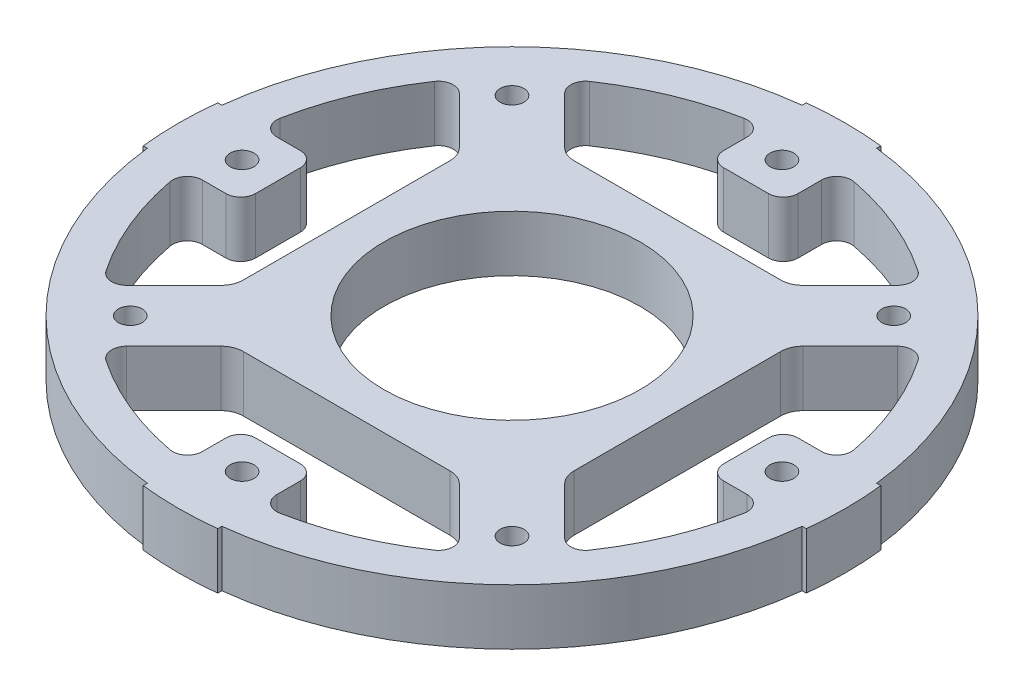
from build123d import *

# Parameters (mm, degrees)
SKETCH1_R           = 1.6
BOSS_EXTRUDE1_DEPTH = 7.5
SKETCH2_R           = 17.2
BOSS_EXTRUDE2_DEPTH = 7.5


with BuildPart() as part:
    # Sketch1 → Boss-Extrude1 (new body)
    with BuildSketch(Plane(origin=(0, 0, 0), x_dir=(1, 0, 0), z_dir=(0, 1, 0))):
        with BuildLine():
            Line((-5, 43.966606646), (-5, 44.520107817))
            ThreePointArc((-5, 44.520107817), (0, 44.8), (5, 44.520107817))
            Line((5, 44.520107817), (5, 43.966606646))
            ThreePointArc((5, 43.966606646), (31.289475068, 31.289475068), (43.966606646, 5))
            Line((43.966606646, 5), (44.520107817, 5))
            ThreePointArc((44.520107817, 5), (44.8, 0), (44.520107817, -5))
            Line((44.520107817, -5), (43.966606646, -5))
            ThreePointArc((43.966606646, -5), (31.289475068, -31.289475068), (5, -43.966606646))
            Line((5, -43.966606646), (5, -44.520107817))
            ThreePointArc((5, -44.520107817), (0, -44.8), (-5, -44.520107817))
            Line((-5, -44.520107817), (-5, -43.966606646))
            ThreePointArc((-5, -43.966606646), (-31.289475068, -31.289475068), (-43.966606646, -5))
            Line((-43.966606646, -5), (-44.520107817, -5))
            ThreePointArc((-44.520107817, -5), (-44.8, 0), (-44.520107817, 5))
            Line((-44.520107817, 5), (-43.966606646, 5))
            ThreePointArc((-43.966606646, 5), (-31.289475068, 31.289475068), (-5, 43.966606646))
        make_face()
        with Locations(Location((36.25, 0, 0), (0, 0, 270))):
            Circle(SKETCH1_R, mode=Mode.SUBTRACT)
        with Locations(Location((25.632620818, -25.632620818, 0), (0, 0, 270))):
            Circle(SKETCH1_R, mode=Mode.SUBTRACT)
        with Locations(Location((0, -36.25, 0), (0, 0, 270))):
            Circle(SKETCH1_R, mode=Mode.SUBTRACT)
        with Locations(Location((-25.632620818, -25.632620818, 0), (0, 0, 270))):
            Circle(SKETCH1_R, mode=Mode.SUBTRACT)
        with Locations(Location((-36.25, 0, 0), (0, 0, 270))):
            Circle(SKETCH1_R, mode=Mode.SUBTRACT)
        with Locations(Location((-25.632620818, 25.632620818, 0), (0, 0, 270))):
            Circle(SKETCH1_R, mode=Mode.SUBTRACT)
        with Locations(Location((0, 36.25, 0), (0, 0, 270))):
            Circle(SKETCH1_R, mode=Mode.SUBTRACT)
        with Locations(Location((25.632620818, 25.632620818, 0), (0, 0, 270))):
            Circle(SKETCH1_R, mode=Mode.SUBTRACT)
        with BuildLine():
            Line((33.430226046, 5), (36.586370413, 5))
            ThreePointArc((36.586370413, 5), (38.127746073, 5.725574218), (38.550739294, 7.375838926))
            ThreePointArc((38.550739294, 7.375838926), (36.262271651, 15.02032472), (32.474994896, 22.043983453))
            ThreePointArc((32.474994896, 22.043983453), (31.008980156, 22.911795444), (29.406004524, 22.334936712))
            Line((29.406004524, 22.334936712), (25.760059877, 18.688992065))
            Line((25.760059877, 18.688992065), (18.688992065, 25.760059877))
            Line((18.688992065, 25.760059877), (22.334936712, 29.406004524))
            ThreePointArc((22.334936712, 29.406004524), (22.911795444, 31.008980156), (22.043983453, 32.474994896))
            ThreePointArc((22.043983453, 32.474994896), (15.02032472, 36.262271651), (7.375838926, 38.550739294))
            ThreePointArc((7.375838926, 38.550739294), (5.725574218, 38.127746073), (5, 36.586370413))
            Line((5, 36.586370413), (5, 33.430226046))
            ThreePointArc((5, 33.430226046), (4.414213562, 32.016012484), (3, 31.430226046))
            Line((3, 31.430226046), (-3, 31.430226046))
            ThreePointArc((-3, 31.430226046), (-4.414213562, 32.016012484), (-5, 33.430226046))
            Line((-5, 33.430226046), (-5, 36.586370413))
            ThreePointArc((-5, 36.586370413), (-5.725574218, 38.127746073), (-7.375838926, 38.550739294))
            ThreePointArc((-7.375838926, 38.550739294), (-15.02032472, 36.262271651), (-22.043983453, 32.474994896))
            ThreePointArc((-22.043983453, 32.474994896), (-22.911795444, 31.008980156), (-22.334936712, 29.406004524))
            Line((-22.334936712, 29.406004524), (-18.688992065, 25.760059877))
            Line((-18.688992065, 25.760059877), (-25.760059877, 18.688992065))
            Line((-25.760059877, 18.688992065), (-29.406004524, 22.334936712))
            ThreePointArc((-29.406004524, 22.334936712), (-31.008980156, 22.911795444), (-32.474994896, 22.043983453))
            ThreePointArc((-32.474994896, 22.043983453), (-36.262271651, 15.02032472), (-38.550739294, 7.375838926))
            ThreePointArc((-38.550739294, 7.375838926), (-38.127746073, 5.725574218), (-36.586370413, 5))
            Line((-36.586370413, 5), (-33.430226046, 5))
            ThreePointArc((-33.430226046, 5), (-32.016012484, 4.414213562), (-31.430226046, 3))
            Line((-31.430226046, 3), (-31.430226046, -3))
            ThreePointArc((-31.430226046, -3), (-32.016012484, -4.414213562), (-33.430226046, -5))
            Line((-33.430226046, -5), (-36.586370413, -5))
            ThreePointArc((-36.586370413, -5), (-38.127746073, -5.725574218), (-38.550739294, -7.375838926))
            ThreePointArc((-38.550739294, -7.375838926), (-36.262271651, -15.02032472), (-32.474994896, -22.043983453))
            ThreePointArc((-32.474994896, -22.043983453), (-31.008980156, -22.911795444), (-29.406004524, -22.334936712))
            Line((-29.406004524, -22.334936712), (-25.760059877, -18.688992065))
            Line((-25.760059877, -18.688992065), (-18.688992065, -25.760059877))
            Line((-18.688992065, -25.760059877), (-22.334936712, -29.406004524))
            ThreePointArc((-22.334936712, -29.406004524), (-22.911795444, -31.008980156), (-22.043983453, -32.474994896))
            ThreePointArc((-22.043983453, -32.474994896), (-15.02032472, -36.262271651), (-7.375838926, -38.550739294))
            ThreePointArc((-7.375838926, -38.550739294), (-5.725574218, -38.127746073), (-5, -36.586370413))
            Line((-5, -36.586370413), (-5, -33.430226046))
            ThreePointArc((-5, -33.430226046), (-4.414213562, -32.016012484), (-3, -31.430226046))
            Line((-3, -31.430226046), (3, -31.430226046))
            ThreePointArc((3, -31.430226046), (4.414213562, -32.016012484), (5, -33.430226046))
            Line((5, -33.430226046), (5, -36.586370413))
            ThreePointArc((5, -36.586370413), (5.725574218, -38.127746073), (7.375838926, -38.550739294))
            ThreePointArc((7.375838926, -38.550739294), (15.02032472, -36.262271651), (22.043983453, -32.474994896))
            ThreePointArc((22.043983453, -32.474994896), (22.911795444, -31.008980156), (22.334936712, -29.406004524))
            Line((22.334936712, -29.406004524), (18.688992065, -25.760059877))
            Line((18.688992065, -25.760059877), (25.760059877, -18.688992065))
            Line((25.760059877, -18.688992065), (29.406004524, -22.334936712))
            ThreePointArc((29.406004524, -22.334936712), (31.008980156, -22.911795444), (32.474994896, -22.043983453))
            ThreePointArc((32.474994896, -22.043983453), (36.262271651, -15.02032472), (38.550739294, -7.375838926))
            ThreePointArc((38.550739294, -7.375838926), (38.127746073, -5.725574218), (36.586370413, -5))
            Line((36.586370413, -5), (33.430226046, -5))
            ThreePointArc((33.430226046, -5), (32.016012484, -4.414213562), (31.430226046, -3))
            Line((31.430226046, -3), (31.430226046, 3))
            ThreePointArc((31.430226046, 3), (32.016012484, 4.414213562), (33.430226046, 5))
        make_face(mode=Mode.SUBTRACT)
    extrude(amount=BOSS_EXTRUDE1_DEPTH)

    # Sketch2 → Boss-Extrude2 (add)
    with BuildSketch(Plane(origin=(0, 7.5, 0), x_dir=(1, 0, 0), z_dir=(0, 1, 0))):
        with BuildLine():
            Line((13.886291501, 22.2), (-13.886291501, 22.2))
            ThreePointArc((-13.886291501, 22.2), (-15.034341798, 22.428361402), (-16.007611845, 23.078679656))
            Line((-16.007611845, 23.078679656), (-18.688992065, 25.760059877))
            Line((-18.688992065, 25.760059877), (-25.760059877, 18.688992065))
            Line((-25.760059877, 18.688992065), (-23.078679656, 16.007611845))
            ThreePointArc((-23.078679656, 16.007611845), (-22.428361402, 15.034341798), (-22.2, 13.886291501))
            Line((-22.2, 13.886291501), (-22.2, -13.886291501))
            ThreePointArc((-22.2, -13.886291501), (-22.428361402, -15.034341798), (-23.078679656, -16.007611845))
            Line((-23.078679656, -16.007611845), (-25.760059877, -18.688992065))
            Line((-25.760059877, -18.688992065), (-18.688992065, -25.760059877))
            Line((-18.688992065, -25.760059877), (-16.007611845, -23.078679656))
            ThreePointArc((-16.007611845, -23.078679656), (-15.034341798, -22.428361402), (-13.886291501, -22.2))
            Line((-13.886291501, -22.2), (13.886291501, -22.2))
            ThreePointArc((13.886291501, -22.2), (15.034341798, -22.428361402), (16.007611845, -23.078679656))
            Line((16.007611845, -23.078679656), (18.688992065, -25.760059877))
            Line((18.688992065, -25.760059877), (25.760059877, -18.688992065))
            Line((25.760059877, -18.688992065), (23.078679656, -16.007611845))
            ThreePointArc((23.078679656, -16.007611845), (22.428361402, -15.034341798), (22.2, -13.886291501))
            Line((22.2, -13.886291501), (22.2, 13.886291501))
            ThreePointArc((22.2, 13.886291501), (22.428361402, 15.034341798), (23.078679656, 16.007611845))
            Line((23.078679656, 16.007611845), (25.760059877, 18.688992065))
            Line((25.760059877, 18.688992065), (18.688992065, 25.760059877))
            Line((18.688992065, 25.760059877), (16.007611845, 23.078679656))
            ThreePointArc((16.007611845, 23.078679656), (15.034341798, 22.428361402), (13.886291501, 22.2))
        make_face()
        with Locations(Location((0, 0, 0), (0, 0, 270))):
            Circle(SKETCH2_R, mode=Mode.SUBTRACT)
    extrude(amount=-BOSS_EXTRUDE2_DEPTH)


solid = part.part
